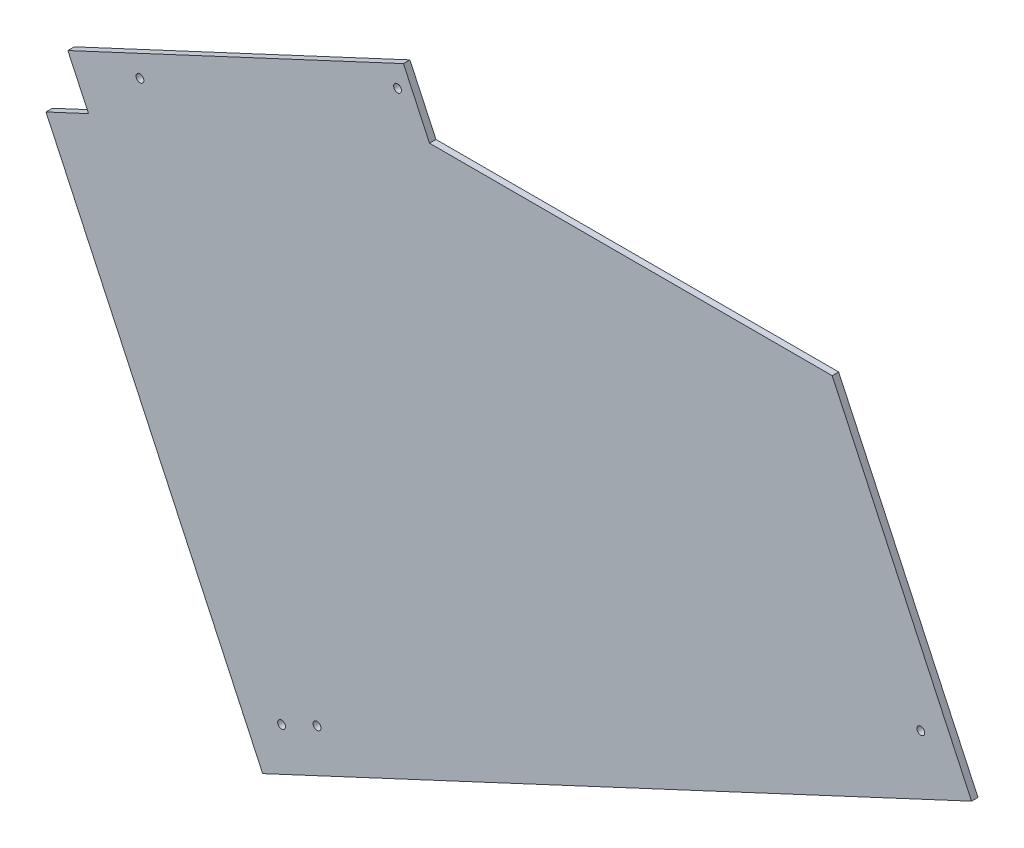
from build123d import *

# Parameters (mm, degrees)
SKETCH1_R           = 2
BOSS_EXTRUDE1_DEPTH = 3.3
SKETCH2_R           = 2
CUT_EXTRUDE1_DEPTH  = 513.420535354
SKETCH3_R           = 2
CUT_EXTRUDE2_DEPTH  = 4


with BuildPart() as part:
    # Sketch1 → Boss-Extrude1 (new body)
    with BuildSketch(Plane.XY):
        Polygon((327.436217585, 0.003466677), (121.498383462, 0.003466677), (108.169003487, 28.58841428), (-63.446663307, -51.437285405), (-52.881206764, -74.094980081), (-74.632593653, -84.237818363), (36.177914576, -321.871720124), (57.929301464, -311.728881842), (398.70102939, -152.824415428), align=None)
        with Locations(Location((372.759364157, -134.57831982, 0), (0, 0, 180))):
            Circle(SKETCH1_R, mode=Mode.SUBTRACT)
    extrude(amount=BOSS_EXTRUDE1_DEPTH)

    # Sketch2 → Cut-Extrude1 (cut, through all)
    with BuildSketch(Plane.XY.offset(3.3)):
        with Locations((105.144723808, 16.144390316)):
            Circle(SKETCH2_R)
        with Locations((-26.593400357, -45.286105853)):
            Circle(SKETCH2_R)
    extrude(amount=-CUT_EXTRUDE1_DEPTH, mode=Mode.SUBTRACT)

    # Sketch3 → Cut-Extrude2 (cut)
    with BuildSketch(Plane.XY.offset(3.3)):
        with Locations((45.851705082, -295.293199148)):
            Circle(SKETCH3_R)
        with Locations((63.977860822, -286.840833914)):
            Circle(SKETCH3_R)
    extrude(amount=-CUT_EXTRUDE2_DEPTH, mode=Mode.SUBTRACT)


solid = part.part
